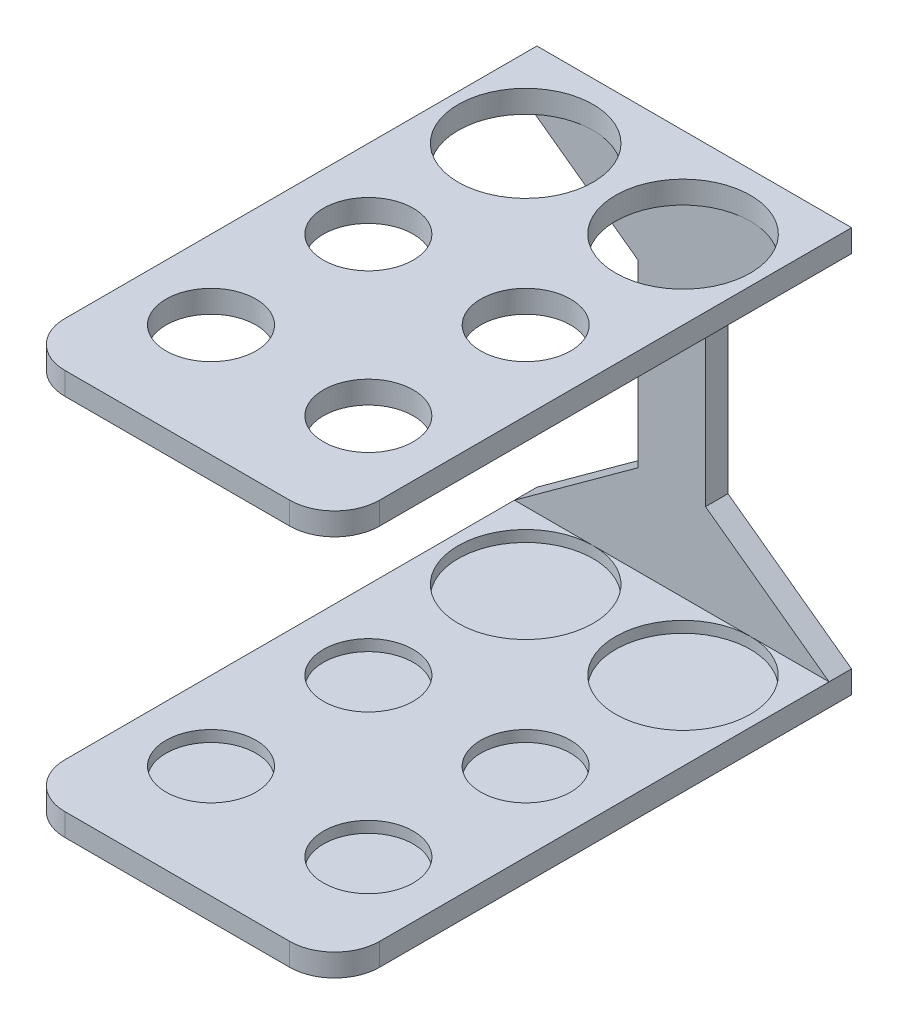
from build123d import *

# Parameters (mm, degrees)
SKETCH1_W               = 139.7
SKETCH1_H               = 6.35
SKETCH1_W_2             = 6.35
SKETCH1_H_2             = 114.3
BOSS_EXTRUDE1_DEPTH     = 88.9
SKETCH2_R               = 19.05
SKETCH2_R_2             = 12.7
CUT_EXTRUDE1_DEPTH      = 111.125
CUT_EXTRUDE3_DEPTH      = 202.205839875
CUT_EXTRUDE3_DEPTH_BACK = 202.205839875
FILLET1_R               = 12.7


with BuildPart() as part:
    # Sketch1 → Boss-Extrude1 (new body)
    with BuildSketch(Plane(origin=(0, 0, 0), x_dir=(0, 0, -1), z_dir=(1, 0, 0))):
        with Locations((-69.85, 111.125)):
            Rectangle(SKETCH1_W, SKETCH1_H)
        with Locations((3.175, 57.15)):
            Rectangle(SKETCH1_W_2, SKETCH1_H_2)
        with Locations((-69.85, 3.175)):
            Rectangle(SKETCH1_W, SKETCH1_H)
    extrude(amount=BOSS_EXTRUDE1_DEPTH)

    # Sketch2 → Cut-Extrude1 (cut)
    with BuildSketch(Plane(origin=(0, 114.3, 0), x_dir=(1, 0, 0), z_dir=(0, 1, 0))):
        with Locations(Location((66.675, -19.05, 0), (0, 0, 270))):
            Circle(SKETCH2_R)
        with Locations(Location((66.675, -63.5, 0), (0, 0, 270))):
            Circle(SKETCH2_R_2)
        with Locations(Location((66.675, -107.95, 0), (0, 0, 270))):
            Circle(SKETCH2_R_2)
        with Locations(Location((22.225, -107.95, 0), (0, 0, 270))):
            Circle(SKETCH2_R_2)
        with Locations(Location((22.225, -63.5, 0), (0, 0, 270))):
            Circle(SKETCH2_R_2)
        with Locations(Location((22.225, -19.05, 0), (0, 0, 270))):
            Circle(SKETCH2_R)
    extrude(amount=-CUT_EXTRUDE1_DEPTH, mode=Mode.SUBTRACT)

    # Sketch4 → Cut-Extrude3 (cut, two sides: drawn at the far end of the back side and taken through both)
    with BuildSketch(Plane.XY.offset(-CUT_EXTRUDE3_DEPTH_BACK)):
        Polygon((34.925, 31.75), (34.925, 82.55), (0, 107.95), (0, 6.35), align=None)
        Polygon((53.975, 82.55), (53.975, 31.75), (88.9, 6.35), (88.9, 107.95), align=None)
    extrude(amount=CUT_EXTRUDE3_DEPTH + CUT_EXTRUDE3_DEPTH_BACK, mode=Mode.SUBTRACT)

    # Fillet1
    fillet1_edges = [part.edges().sort_by_distance(p)[0] for p in [
        (88.9, 111.125, 139.7),
        (0, 3.175, 139.7),
        (0, 111.125, 139.7),
        (88.9, 3.175, 139.7),
    ]]
    fillet(fillet1_edges, radius=FILLET1_R)


solid = part.part
